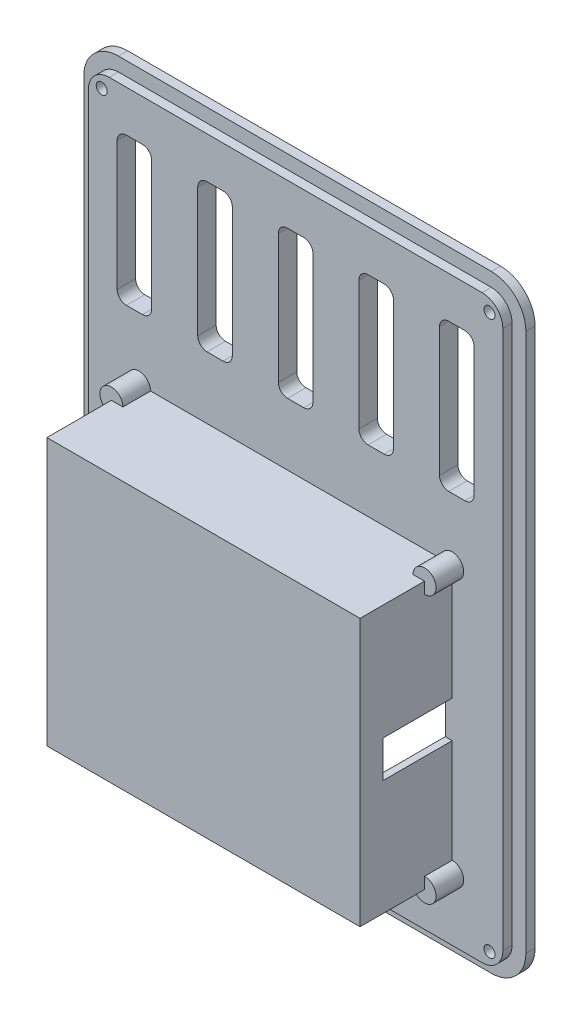
from build123d import *

# Parameters (mm, degrees)
BOSS_EXTRUDE1_DEPTH                              = 2
BOSS_EXTRUDE2_DEPTH                              = 2
CUT_EXTRUDE1_DEPTH                               = 82.706792863
CBORE_FOR_M2_PAN_HEAD_MACHINE_SCREW1_D           = 2.4
CBORE_FOR_M2_PAN_HEAD_MACHINE_SCREW1_CBORE_D     = 5
CBORE_FOR_M2_PAN_HEAD_MACHINE_SCREW1_CBORE_DEPTH = 1.6
BOSS_EXTRUDE3_START                              = -4
SKETCH8_3_W                                      = 68
SKETCH8_3_H                                      = 58
BOSS_EXTRUDE3_DEPTH                              = 20
SKETCH8_W                                        = 65
SKETCH8_H                                        = 55
CUT_EXTRUDE2_DEPTH                               = 22
SKETCH9_W                                        = 73
SKETCH9_H                                        = 63
CUT_EXTRUDE3_DEPTH                               = 2
BOSS_EXTRUDE4_DEPTH                              = 6
CSK_FOR_M2_FLAT_HEAD_MACHINE_SCREW2_D            = 3
CSK_FOR_M2_FLAT_HEAD_MACHINE_SCREW2_DEPTH        = 6
CSK_FOR_M2_FLAT_HEAD_MACHINE_SCREW2_CSINK_D      = 3.27
CSK_FOR_M2_FLAT_HEAD_MACHINE_SCREW2_CSINK_ANGLE  = 30
CSK_FOR_M2_FLAT_HEAD_MACHINE_SCREW2_TIP          = 0.901290929
SKETCH15_W                                       = 15
SKETCH15_H                                       = 8
CUT_EXTRUDE4_DEPTH                               = 108.53604047
CUT_EXTRUDE5_DEPTH                               = 86.064681273


with BuildPart() as part:
    # Sketch2 → Boss-Extrude1 (new body)
    with BuildSketch(Plane.XY):
        with BuildLine():
            Line((45, -58.5), (45, 58.5))
            ThreePointArc((45, 58.5), (43.681980515, 61.681980515), (40.5, 63))
            Line((40.5, 63), (-40.5, 63))
            ThreePointArc((-40.5, 63), (-43.681980515, 61.681980515), (-45, 58.5))
            Line((-45, 58.5), (-45, -58.5))
            ThreePointArc((-45, -58.5), (-43.681980515, -61.681980515), (-40.5, -63))
            Line((-40.5, -63), (40.5, -63))
            ThreePointArc((40.5, -63), (43.681980515, -61.681980515), (45, -58.5))
        make_face()
    extrude(amount=BOSS_EXTRUDE1_DEPTH)

    # Sketch3 → Boss-Extrude2 (add)
    with BuildSketch(Plane(origin=(0, 0, 0), x_dir=(-1, 0, 0), z_dir=(0, 0, -1))):
        with BuildLine():
            Line((-40.5, -66), (40.5, -66))
            ThreePointArc((40.5, -66), (45.803300859, -63.803300859), (48, -58.5))
            Line((48, -58.5), (48, 58.5))
            ThreePointArc((48, 58.5), (45.803300859, 63.803300859), (40.5, 66))
            Line((40.5, 66), (-40.5, 66))
            ThreePointArc((-40.5, 66), (-45.803300859, 63.803300859), (-48, 58.5))
            Line((-48, 58.5), (-48, -58.5))
            ThreePointArc((-48, -58.5), (-45.803300859, -63.803300859), (-40.5, -66))
        make_face()
    extrude(amount=BOSS_EXTRUDE2_DEPTH)

    # Sketch5 → Cut-Extrude1 (cut, through all)
    with BuildSketch(Plane(origin=(0, 0, -2), x_dir=(-1, 0, 0), z_dir=(0, 0, -1))):
        with BuildLine():
            Line((-36.75, 22), (-33.25, 22))
            ThreePointArc((-33.25, 22), (-31.835786438, 22.585786438), (-31.25, 24))
            Line((-31.25, 24), (-31.25, 52))
            ThreePointArc((-31.25, 52), (-31.835786438, 53.414213562), (-33.25, 54))
            Line((-33.25, 54), (-36.75, 54))
            ThreePointArc((-36.75, 54), (-38.164213562, 53.414213562), (-38.75, 52))
            Line((-38.75, 52), (-38.75, 24))
            ThreePointArc((-38.75, 24), (-38.164213562, 22.585786438), (-36.75, 22))
        make_face()
        with BuildLine():
            Line((-21.25, 24), (-21.25, 52))
            ThreePointArc((-21.25, 52), (-20.664213562, 53.414213562), (-19.25, 54))
            Line((-19.25, 54), (-15.75, 54))
            ThreePointArc((-15.75, 54), (-14.335786438, 53.414213562), (-13.75, 52))
            Line((-13.75, 52), (-13.75, 24))
            ThreePointArc((-13.75, 24), (-14.335786438, 22.585786438), (-15.75, 22))
            Line((-15.75, 22), (-19.25, 22))
            ThreePointArc((-19.25, 22), (-20.664213562, 22.585786438), (-21.25, 24))
        make_face()
        with BuildLine():
            Line((-3.75, 24), (-3.75, 52))
            ThreePointArc((-3.75, 52), (-3.164213562, 53.414213562), (-1.75, 54))
            Line((-1.75, 54), (1.75, 54))
            ThreePointArc((1.75, 54), (3.164213562, 53.414213562), (3.75, 52))
            Line((3.75, 52), (3.75, 24))
            ThreePointArc((3.75, 24), (3.164213562, 22.585786438), (1.75, 22))
            Line((1.75, 22), (-1.75, 22))
            ThreePointArc((-1.75, 22), (-3.164213562, 22.585786438), (-3.75, 24))
        make_face()
        with BuildLine():
            Line((13.75, 24), (13.75, 52))
            ThreePointArc((13.75, 52), (14.335786438, 53.414213562), (15.75, 54))
            Line((15.75, 54), (19.25, 54))
            ThreePointArc((19.25, 54), (20.664213562, 53.414213562), (21.25, 52))
            Line((21.25, 52), (21.25, 24))
            ThreePointArc((21.25, 24), (20.664213562, 22.585786438), (19.25, 22))
            Line((19.25, 22), (15.75, 22))
            ThreePointArc((15.75, 22), (14.335786438, 22.585786438), (13.75, 24))
        make_face()
        with BuildLine():
            Line((31.25, 24), (31.25, 52))
            ThreePointArc((31.25, 52), (31.835786438, 53.414213562), (33.25, 54))
            Line((33.25, 54), (36.75, 54))
            ThreePointArc((36.75, 54), (38.164213562, 53.414213562), (38.75, 52))
            Line((38.75, 52), (38.75, 24))
            ThreePointArc((38.75, 24), (38.164213562, 22.585786438), (36.75, 22))
            Line((36.75, 22), (33.25, 22))
            ThreePointArc((33.25, 22), (31.835786438, 22.585786438), (31.25, 24))
        make_face()
    extrude(amount=-CUT_EXTRUDE1_DEPTH, mode=Mode.SUBTRACT)

    # CBORE for M2 Pan Head Machine Screw1 (through all)
    with Locations(Plane(origin=(0, 0, -2), x_dir=(-1, 0, 0), z_dir=(0, 0, -1))):
        with Locations((-42.1, 60.1), (42.1, 60.1), (-42.1, -60.1), (42.1, -60.1)):
            CounterBoreHole(CBORE_FOR_M2_PAN_HEAD_MACHINE_SCREW1_D / 2, CBORE_FOR_M2_PAN_HEAD_MACHINE_SCREW1_CBORE_D / 2, CBORE_FOR_M2_PAN_HEAD_MACHINE_SCREW1_CBORE_DEPTH)

    # Sketch8<3> → Boss-Extrude3 (add)
    with BuildSketch(Plane(origin=(0, 0, -2), x_dir=(-1, 0, 0), z_dir=(0, 0, -1)).offset(BOSS_EXTRUDE3_START)):
        with Locations((0, -20.5)):
            Rectangle(SKETCH8_3_W, SKETCH8_3_H)
    extrude(amount=-BOSS_EXTRUDE3_DEPTH)

    # Sketch8 → Cut-Extrude2 (cut)
    with BuildSketch(Plane(origin=(0, 0, -2), x_dir=(-1, 0, 0), z_dir=(0, 0, -1))):
        with Locations((0, -20.5)):
            Rectangle(SKETCH8_W, SKETCH8_H)
    extrude(amount=-CUT_EXTRUDE2_DEPTH, mode=Mode.SUBTRACT)

    # Sketch9 → Cut-Extrude3 (cut)
    with BuildSketch(Plane(origin=(0, 0, -2), x_dir=(-1, 0, 0), z_dir=(0, 0, -1))):
        with Locations((0, -20.5)):
            Rectangle(SKETCH9_W, SKETCH9_H)
    extrude(amount=-CUT_EXTRUDE3_DEPTH, mode=Mode.SUBTRACT)

    # Sketch10 → Boss-Extrude4 (add)
    with BuildSketch(Plane.XY.offset(2)):
        with BuildLine():
            Line((32.5, 7), (32, 7))
            ThreePointArc((32, 7), (35.767766953, 10.267766953), (32.5, 6.5))
            Line((32.5, 6.5), (32.5, 7))
        make_face()
        with BuildLine():
            Line((-32.5, 7), (-32.5, 6.5))
            ThreePointArc((-32.5, 6.5), (-35.767766953, 10.267766953), (-32, 7))
            Line((-32, 7), (-32.5, 7))
        make_face()
        with BuildLine():
            Line((-32.5, -48), (-32, -48))
            ThreePointArc((-32, -48), (-35.767766953, -51.267766953), (-32.5, -47.5))
            Line((-32.5, -47.5), (-32.5, -48))
        make_face()
        with BuildLine():
            Line((32.5, -48), (32.5, -47.5))
            ThreePointArc((32.5, -47.5), (35.767766953, -51.267766953), (32, -48))
            Line((32, -48), (32.5, -48))
        make_face()
    extrude(amount=BOSS_EXTRUDE4_DEPTH)

    # CSK for M2 Flat Head Machine Screw2
    with Locations(Plane(origin=(0, 0, 0), x_dir=(-1, 0, 0), z_dir=(0, 0, -1))):
        with Locations((-34, 8.5), (34, 8.5), (-34, -49.5), (34, -49.5)):
            CounterSinkHole(CSK_FOR_M2_FLAT_HEAD_MACHINE_SCREW2_D / 2, CSK_FOR_M2_FLAT_HEAD_MACHINE_SCREW2_CSINK_D / 2, depth=CSK_FOR_M2_FLAT_HEAD_MACHINE_SCREW2_DEPTH, counter_sink_angle=CSK_FOR_M2_FLAT_HEAD_MACHINE_SCREW2_CSINK_ANGLE)
            with Locations((0, 0, -(CSK_FOR_M2_FLAT_HEAD_MACHINE_SCREW2_DEPTH + CSK_FOR_M2_FLAT_HEAD_MACHINE_SCREW2_TIP / 2))):  # 118° drill point
                Cone(0, CSK_FOR_M2_FLAT_HEAD_MACHINE_SCREW2_D / 2, CSK_FOR_M2_FLAT_HEAD_MACHINE_SCREW2_TIP, mode=Mode.SUBTRACT)

    # Sketch15 → Cut-Extrude4 (cut, through all)
    with BuildSketch(Plane(origin=(34, 0, 0), x_dir=(0, 0, -1), z_dir=(1, 0, 0))):
        with Locations((-9.5, -20.5)):
            Rectangle(SKETCH15_W, SKETCH15_H)
    extrude(amount=-CUT_EXTRUDE4_DEPTH, mode=Mode.SUBTRACT)

    # Sketch16 → Cut-Extrude5 (cut, through all)
    with BuildSketch(Plane(origin=(0, 0, -2), x_dir=(-1, 0, 0), z_dir=(0, 0, -1))):
        with BuildLine():
            Line((2.515812527, -57.4), (-2.515812527, -57.4))
            ThreePointArc((-2.515812527, -57.4), (-2.727890225, -57.352794711), (-2.899923167, -57.2200922))
            Line((-2.899923167, -57.2200922), (-3.88411064, -56.039067232))
            ThreePointArc((-3.88411064, -56.039067232), (-3.970135789, -55.889187664), (-4, -55.718975032))
            Line((-4, -55.718975032), (-4, -54.9))
            ThreePointArc((-4, -54.9), (-3.853553391, -54.546446609), (-3.5, -54.4))
            Line((-3.5, -54.4), (3.5, -54.4))
            ThreePointArc((3.5, -54.4), (3.853553391, -54.546446609), (4, -54.9))
            Line((4, -54.9), (4, -55.718975032))
            ThreePointArc((4, -55.718975032), (3.970135789, -55.889187664), (3.88411064, -56.039067232))
            Line((3.88411064, -56.039067232), (2.899923167, -57.2200922))
            ThreePointArc((2.899923167, -57.2200922), (2.727890225, -57.352794711), (2.515812527, -57.4))
        make_face()
    extrude(amount=-CUT_EXTRUDE5_DEPTH, mode=Mode.SUBTRACT)


solid = part.part
